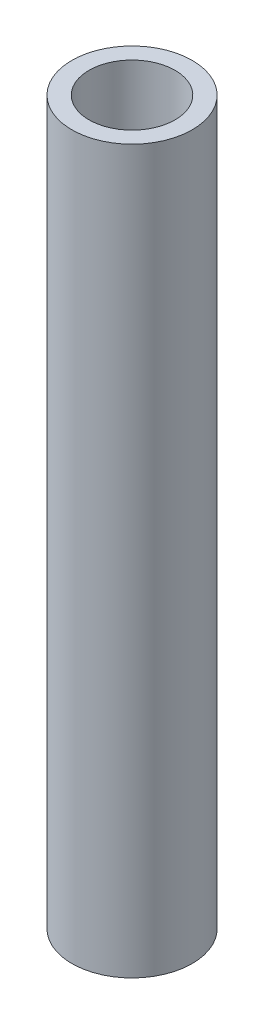
from build123d import *

# Parameters (mm, degrees)
SKETCH1_R           = 3.5
SKETCH1_R_2         = 2.5
BOSS_EXTRUDE1_DEPTH = 42


with BuildPart() as part:
    # Sketch1 → Boss-Extrude1 (new body)
    with BuildSketch(Plane(origin=(0, 0, 0), x_dir=(1, 0, 0), z_dir=(0, 1, 0))):
        with Locations(Location((0, 0, 0), (0, 0, 90))):
            Circle(SKETCH1_R)
        with Locations(Location((0, 0, 0), (0, 0, 90))):
            Circle(SKETCH1_R_2, mode=Mode.SUBTRACT)
    extrude(amount=BOSS_EXTRUDE1_DEPTH)


solid = part.part
